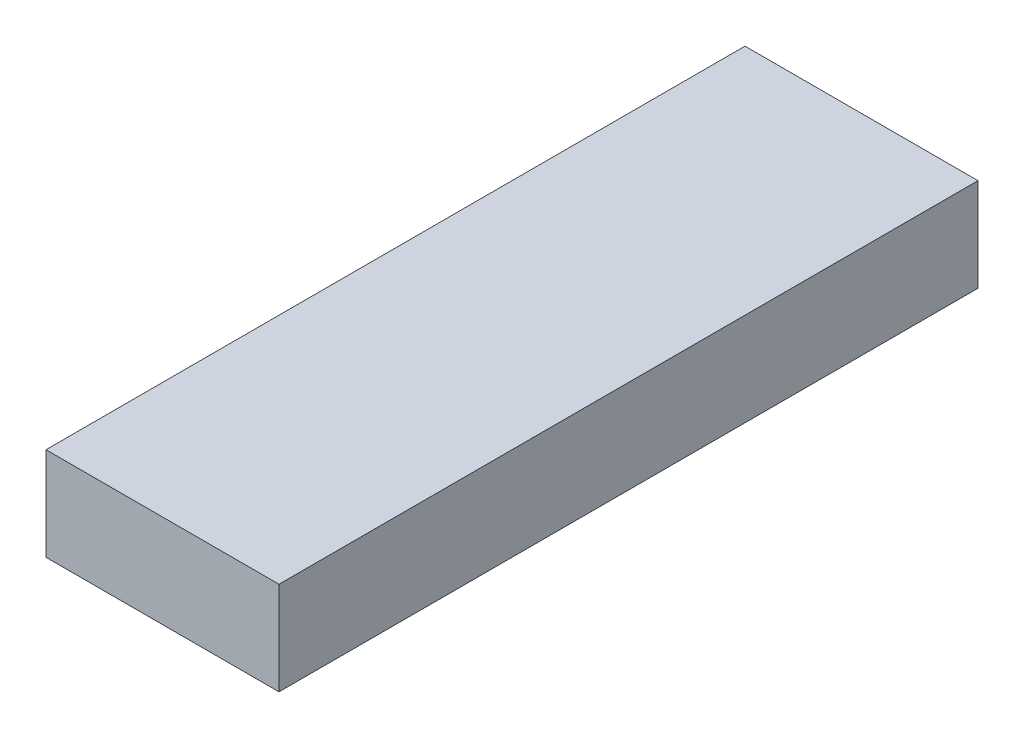
from build123d import *

# Parameters (mm, degrees)
SKETCH1_W           = 10
SKETCH1_H           = 4
BOSS_EXTRUDE1_DEPTH = 30


with BuildPart() as part:
    # Sketch1 → Boss-Extrude1 (new body)
    with BuildSketch(Plane.XY):
        Rectangle(SKETCH1_W, SKETCH1_H)
    extrude(amount=BOSS_EXTRUDE1_DEPTH)


solid = part.part
